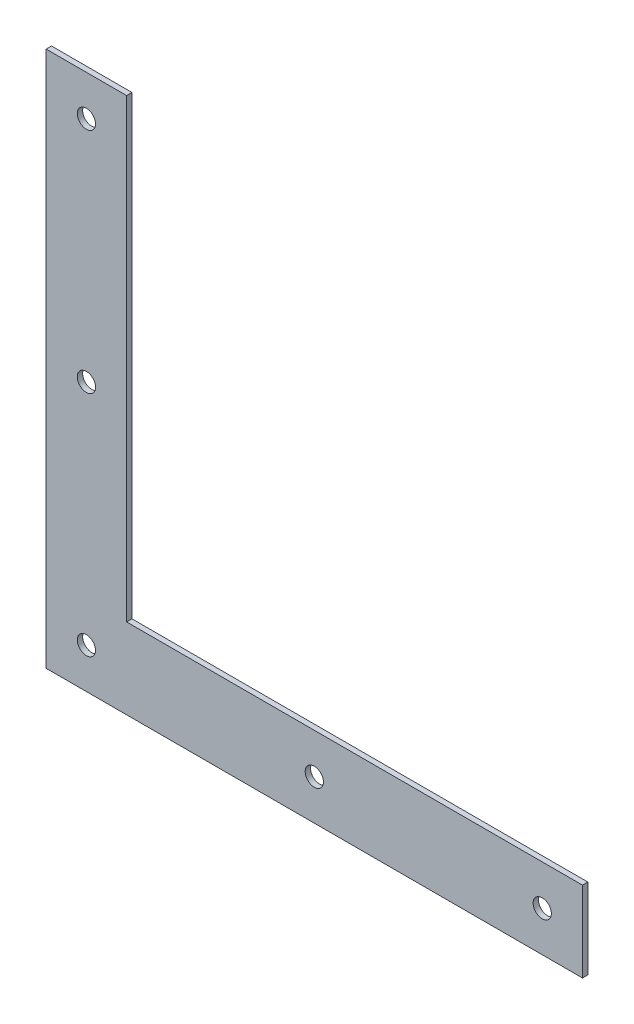
from build123d import *

# Parameters (mm, degrees)
BOSS_EXTRUDE1_DEPTH  = 1
M3_CLEARANCE_HOLE1_D = 3.4


with BuildPart() as part:
    # Sketch1 → Boss-Extrude1 (new body)
    with BuildSketch(Plane.XY):
        Polygon((0, 0), (0, 100), (15, 100), (15, 15), (100, 15), (100, 0), align=None)
    extrude(amount=BOSS_EXTRUDE1_DEPTH)

    # M3 Clearance Hole1 (through all)
    with Locations(Plane(origin=(0, 0, 0), x_dir=(-1, 0, 0), z_dir=(0, 0, -1))):
        with Locations((-92.5, 7.5), (-7.5, 7.5), (-7.5, 92.5), (-7.5, 50), (-50, 7.5)):
            Hole(M3_CLEARANCE_HOLE1_D / 2)


solid = part.part
